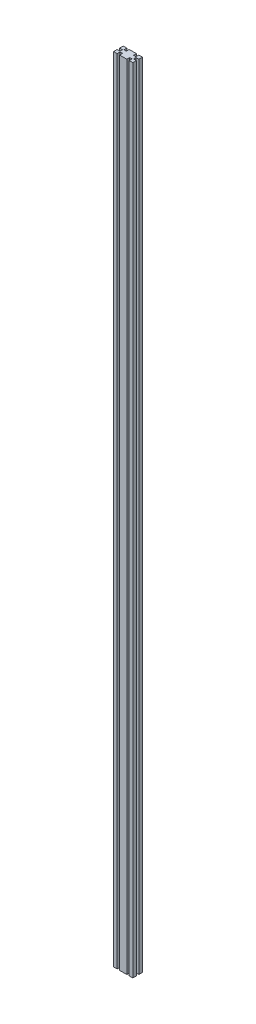
from build123d import *

# Parameters (mm, degrees)
BOSS_EXTRUDE1_DEPTH      = 825.5
BOSS_EXTRUDE1_DEPTH_BACK = 825.5
SKETCH1_W                = 40
SKETCH1_H                = 20
CUT_EXTRUDE1_DEPTH       = 826.802791228
CUT_EXTRUDE1_DEPTH_BACK  = 826.802791228
SKETCH2_W                = 5
SKETCH2_H                = 12
SKETCH2_W_2              = 12
SKETCH2_H_2              = 5


with BuildPart() as part:
    # Sketch1 → Boss-Extrude1 (new, two sides: drawn at the far end of the back side and taken through both)
    with BuildSketch(Plane(origin=(0, 0, 0), x_dir=(1, 0, 0), z_dir=(0, 1, 0)).offset(-BOSS_EXTRUDE1_DEPTH_BACK)):
        Rectangle(SKETCH1_W, SKETCH1_H)
    extrude(amount=BOSS_EXTRUDE1_DEPTH + BOSS_EXTRUDE1_DEPTH_BACK)

    # Sketch2 → Cut-Extrude1 (cut, two sides: drawn at the far end of the back side and taken through both)
    with BuildSketch(Plane(origin=(0, 0, 0), x_dir=(1, 0, 0), z_dir=(0, 1, 0)).offset(-CUT_EXTRUDE1_DEPTH_BACK)):
        with Locations((-10, 10)):
            Rectangle(SKETCH2_W, SKETCH2_H)
        with Locations((-20, 0)):
            Rectangle(SKETCH2_W_2, SKETCH2_H_2)
        with Locations((-10, -10)):
            Rectangle(SKETCH2_W, SKETCH2_H)
        with Locations((10, -10)):
            Rectangle(SKETCH2_W, SKETCH2_H)
        with Locations((20, 0)):
            Rectangle(SKETCH2_W_2, SKETCH2_H_2)
        with Locations((10, 10)):
            Rectangle(SKETCH2_W, SKETCH2_H)
    extrude(amount=CUT_EXTRUDE1_DEPTH + CUT_EXTRUDE1_DEPTH_BACK, mode=Mode.SUBTRACT)


solid = part.part
